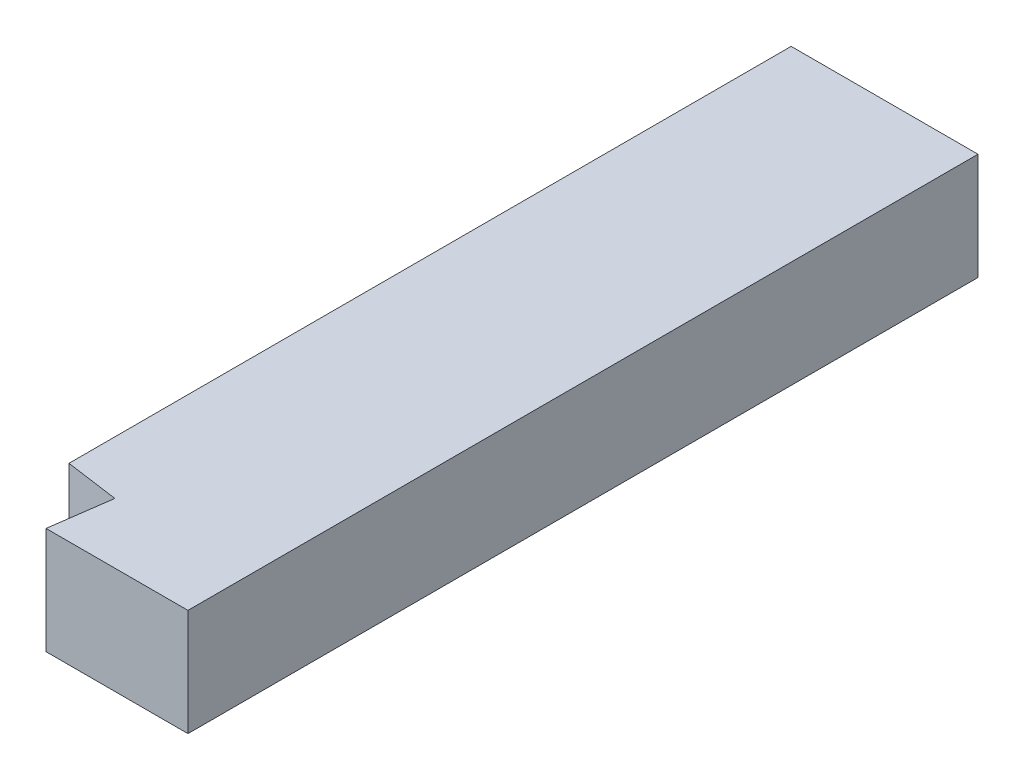
from build123d import *

# Parameters (mm, degrees)
SKETCH1_W               = 101.6
SKETCH1_H               = 50.8
BOSS_EXTRUDE1_DEPTH     = 375.907215418
CUT_EXTRUDE1_DEPTH      = 383.710745346
CUT_EXTRUDE1_DEPTH_BACK = 383.710745346
CUT_EXTRUDE2_DEPTH      = 383.710745346
CUT_EXTRUDE2_DEPTH_BACK = 383.710745346
SKETCH3_W               = 12.7
SKETCH3_H               = 375.907215418


with BuildPart() as part:
    # Sketch1 → Boss-Extrude1 (new body)
    with BuildSketch(Plane.XY):
        Rectangle(SKETCH1_W, SKETCH1_H)
    extrude(amount=BOSS_EXTRUDE1_DEPTH)

    # Sketch2 → Cut-Extrude1 (cut, two sides: drawn at the far end of the back side and taken through both)
    with BuildSketch(Plane(origin=(0, 25.4, 0), x_dir=(1, 0, 0), z_dir=(0, 1, 0)).offset(-CUT_EXTRUDE1_DEPTH_BACK)):
        Polygon((-50.8, -343.610078217), (-25.4, -347.179815418), (-29.437372775, -375.907215418), (-50.8, -375.907215418), align=None)
    extrude(amount=CUT_EXTRUDE1_DEPTH + CUT_EXTRUDE1_DEPTH_BACK, mode=Mode.SUBTRACT)

    # Sketch3 → Cut-Extrude2 (cut, two sides: drawn at the far end of the back side and taken through both)
    with BuildSketch(Plane(origin=(0, 25.4, 0), x_dir=(1, 0, 0), z_dir=(0, 1, 0)).offset(-CUT_EXTRUDE2_DEPTH_BACK)):
        with Locations((44.45, -187.953607709)):
            Rectangle(SKETCH3_W, SKETCH3_H)
    extrude(amount=CUT_EXTRUDE2_DEPTH + CUT_EXTRUDE2_DEPTH_BACK, mode=Mode.SUBTRACT)


solid = part.part
